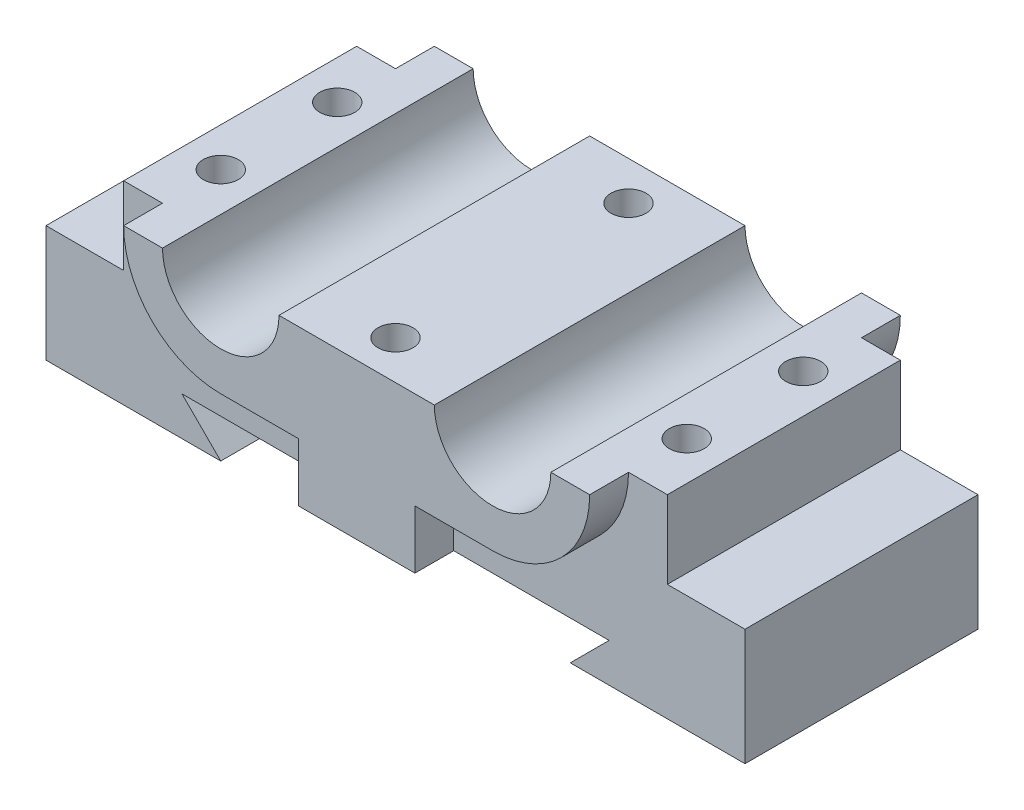
from build123d import *

# Parameters (mm, degrees)
BOSS_EXTRUDE1_DEPTH = 30
BOSS_EXTRUDE2_DEPTH = 40
SKETCH4_R           = 7.5
CUT_EXTRUDE1_DEPTH  = 40
SKETCH5_R           = 2.25
CUT_EXTRUDE2_DEPTH  = 15


with BuildPart() as part:
    # Sketch1 → Boss-Extrude1 (new body)
    with BuildSketch(Plane.XY):
        Polygon((0, 0), (0, 15), (10, 15), (10, 25), (80, 25), (80, 15), (90, 15), (90, 0), (67.5, 0), (72.5, 5), (17.5, 5), (22.5, 0), align=None)
    extrude(amount=BOSS_EXTRUDE1_DEPTH)

    # Sketch3 → Boss-Extrude2 (add)
    with BuildSketch(Plane.XY.offset(-5)):
        with BuildLine():
            Line((45, 5), (52.5, 5))
            Line((52.5, 5), (52.5, 12.5))
            Line((52.5, 12.5), (62.5, 12.5))
            ThreePointArc((62.5, 12.5), (71.338834765, 16.161165235), (75, 25))
            Line((75, 25), (15, 25))
            ThreePointArc((15, 25), (18.661165235, 16.161165235), (27.5, 12.5))
            Line((27.5, 12.5), (37.5, 12.5))
            Line((37.5, 12.5), (37.5, 5))
            Line((37.5, 5), (45, 5))
        make_face()
    extrude(amount=BOSS_EXTRUDE2_DEPTH)

    # Sketch4 → Cut-Extrude1 (cut)
    with BuildSketch(Plane.XY.offset(-5)):
        with Locations((27.5, 25)):
            Circle(SKETCH4_R)
        with Locations((62.5, 25)):
            Circle(SKETCH4_R)
    extrude(amount=CUT_EXTRUDE1_DEPTH, mode=Mode.SUBTRACT)

    # Sketch5 → Cut-Extrude2 (cut)
    with BuildSketch(Plane(origin=(0, 25, 0), x_dir=(1, 0, 0), z_dir=(0, 1, 0))):
        with Locations(Location((15, -7.5, 0), (0, 0, 270))):
            Circle(SKETCH5_R)
        with Locations(Location((15, -22.5, 0), (0, 0, 270))):
            Circle(SKETCH5_R)
        with Locations(Location((45, 0, 0), (0, 0, 270))):
            Circle(SKETCH5_R)
        with Locations(Location((45, -30, 0), (0, 0, 270))):
            Circle(SKETCH5_R)
        with Locations(Location((75, -7.5, 0), (0, 0, 270))):
            Circle(SKETCH5_R)
        with Locations(Location((75, -22.5, 0), (0, 0, 270))):
            Circle(SKETCH5_R)
    extrude(amount=-CUT_EXTRUDE2_DEPTH, mode=Mode.SUBTRACT)


solid = part.part
